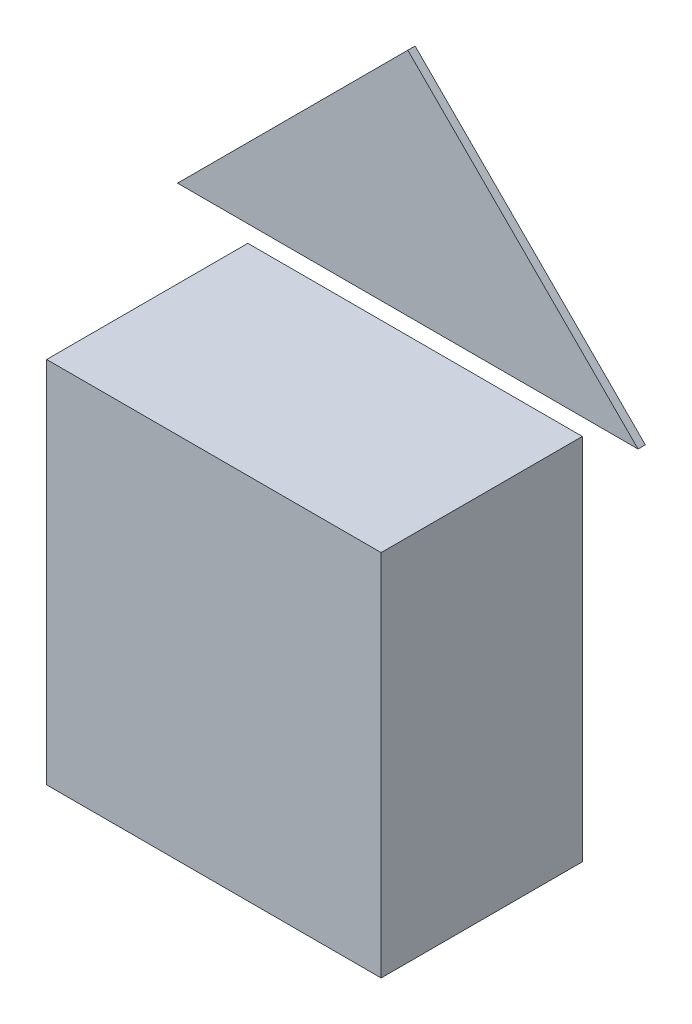
from build123d import *

# Parameters (mm, degrees)
SKETCH2_W           = 1380
SKETCH2_H           = 1520
BOSS_EXTRUDE3_DEPTH = 830
BOSS_EXTRUDE5_DEPTH = 30


with BuildPart() as part:
    # Sketch2 → Boss-Extrude3 (new body)
    with BuildSketch(Plane.XY):
        with Locations((23.262557024, 22.44080113)):
            Rectangle(SKETCH2_W, SKETCH2_H)
    extrude(amount=BOSS_EXTRUDE3_DEPTH)


with BuildPart() as body_2:
    # Sketch3 → Boss-Extrude5 (new body)
    with BuildSketch(Plane.XY):
        Polygon((23.262557024, 1832.44080113), (-926.737442976, 882.44080113), (973.262557024, 882.44080113), align=None)
    extrude(amount=BOSS_EXTRUDE5_DEPTH)


solid = Compound([part.part, body_2.part])
